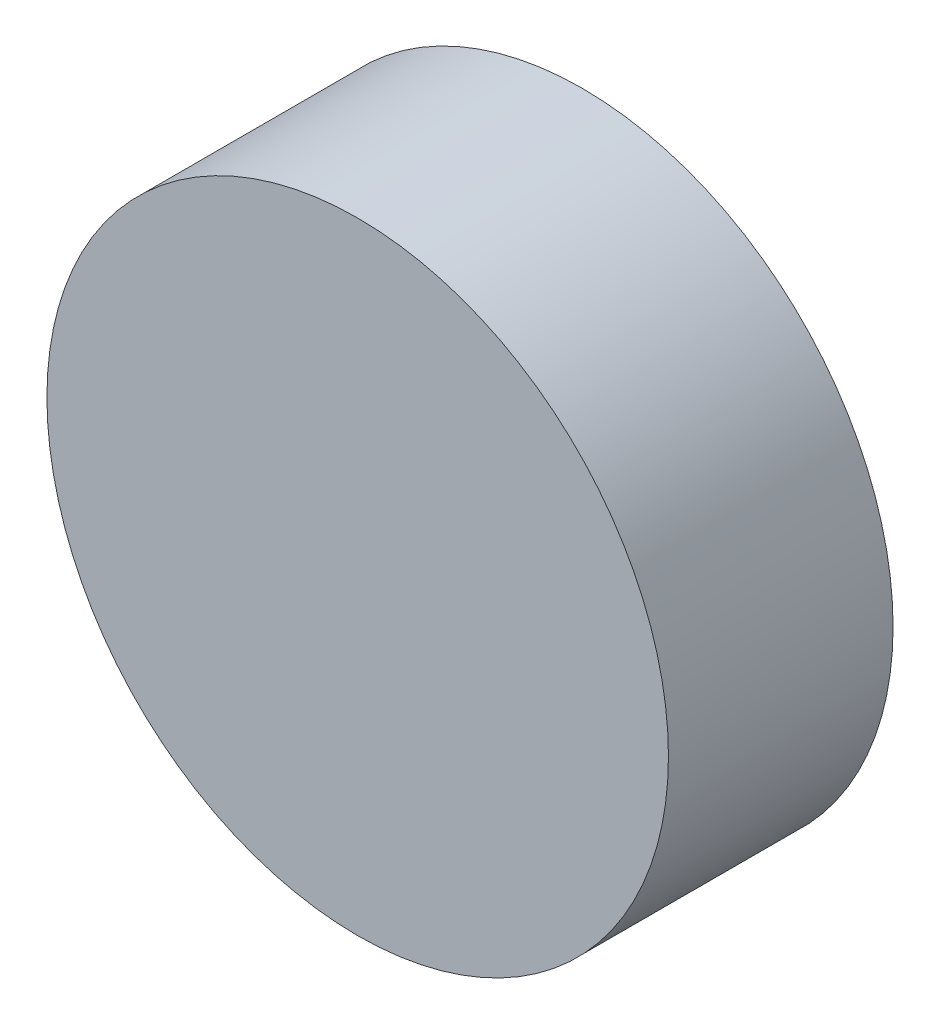
from build123d import *

# Parameters (mm, degrees)
SKETCH_1_R                     = 25
MEASURED_KNOB_D50_H18P07_DEPTH = 18.07


with BuildPart() as part:
    # 草图1 → Measured_knob_D50_H18p07 (new body)
    with BuildSketch(Plane.XY):
        Circle(SKETCH_1_R)
    extrude(amount=MEASURED_KNOB_D50_H18P07_DEPTH)


solid = part.part
